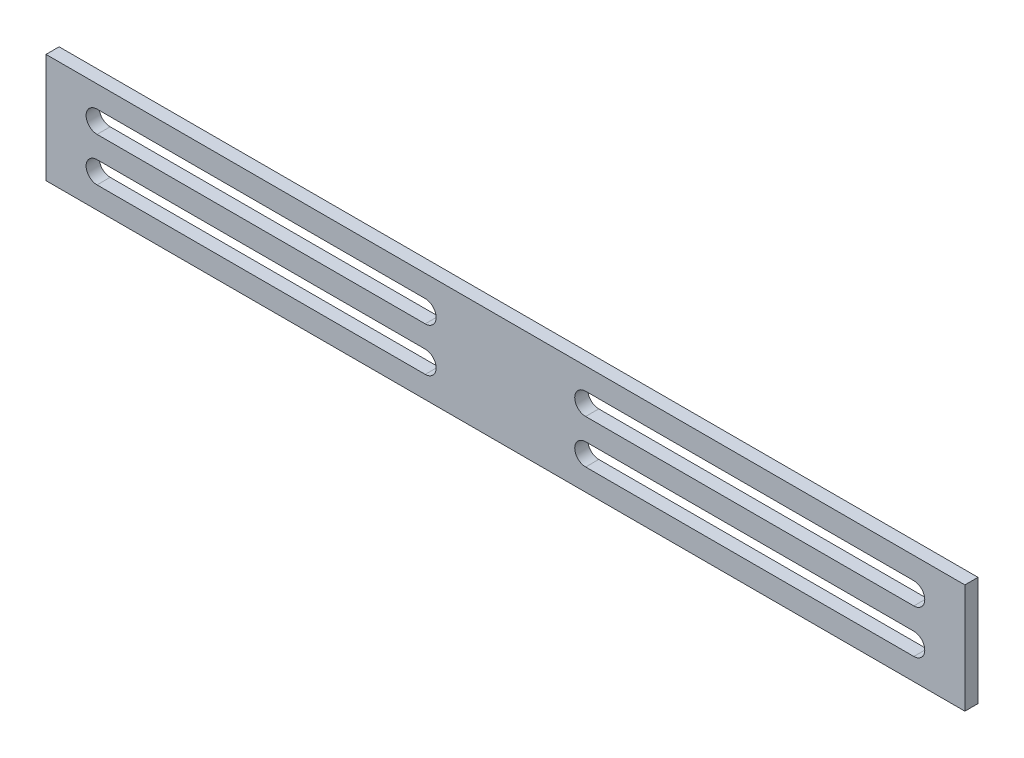
from build123d import *

# Parameters (mm, degrees)
ESBO_O1_W                = 126
ESBO_O1_H                = 15
RESSALTO_EXTRUS_O1_DEPTH = 1.8
CORTE_EXTRUS_O1_DEPTH    = 64.470386796


with BuildPart() as part:
    # Esboço1 → Ressalto-extrusão1 (new body)
    with BuildSketch(Plane.XY):
        Rectangle(ESBO_O1_W, ESBO_O1_H)
    extrude(amount=RESSALTO_EXTRUS_O1_DEPTH)

    # Esboço2 → Corte-extrusão1 (cut, through all)
    with BuildSketch(Plane.XY.offset(1.8)):
        with BuildLine():
            Line((-56, 4.5), (-11, 4.5))
            ThreePointArc((-11, 4.5), (-9.5, 3), (-11, 1.5))
            Line((-11, 1.5), (-56, 1.5))
            ThreePointArc((-56, 1.5), (-57.5, 3), (-56, 4.5))
        make_face()
        with BuildLine():
            Line((-56, -4.5), (-11, -4.5))
            ThreePointArc((-11, -4.5), (-9.5, -3), (-11, -1.5))
            Line((-11, -1.5), (-56, -1.5))
            ThreePointArc((-56, -1.5), (-57.5, -3), (-56, -4.5))
        make_face()
        with BuildLine():
            Line((56, -4.5), (11, -4.5))
            ThreePointArc((11, -4.5), (9.5, -3), (11, -1.5))
            Line((11, -1.5), (56, -1.5))
            ThreePointArc((56, -1.5), (57.5, -3), (56, -4.5))
        make_face()
        with BuildLine():
            Line((56, 4.5), (11, 4.5))
            ThreePointArc((11, 4.5), (9.5, 3), (11, 1.5))
            Line((11, 1.5), (56, 1.5))
            ThreePointArc((56, 1.5), (57.5, 3), (56, 4.5))
        make_face()
    extrude(amount=-CORTE_EXTRUS_O1_DEPTH, mode=Mode.SUBTRACT)


solid = part.part
